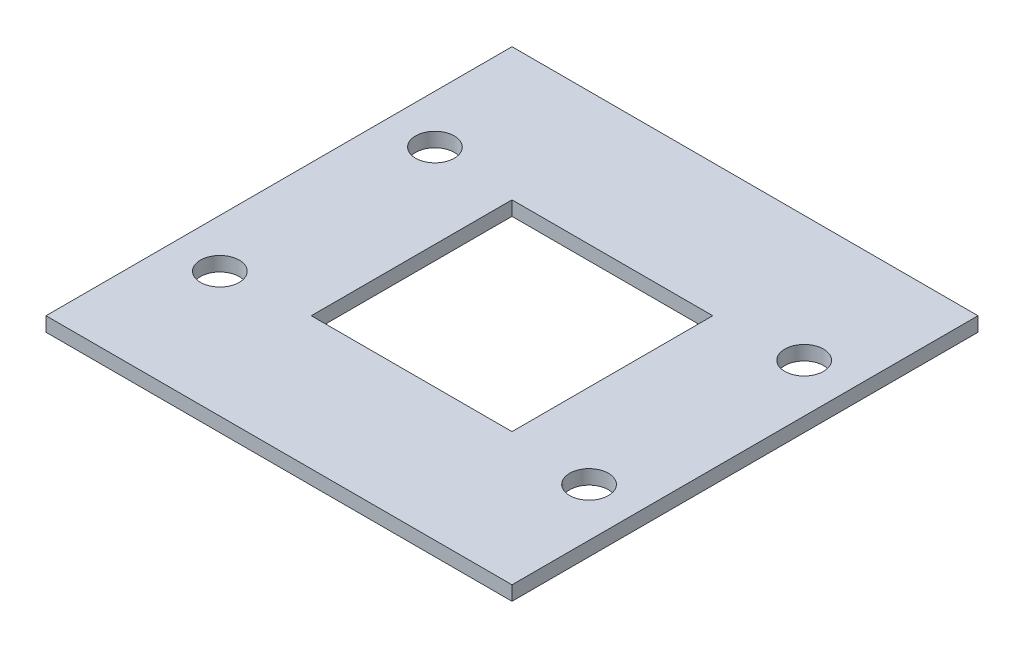
from build123d import *

# Parameters (mm, degrees)
CROQUIS1_W              = 55
CROQUIS1_H              = 55
CROQUIS1_R              = 1.5
SALIENTE_EXTRUIR1_DEPTH = 2
CROQUIS3_W              = 65
CROQUIS3_H              = 65
CROQUIS3_W_2            = 55
CROQUIS3_H_2            = 55
SALIENTE_EXTRUIR2_DEPTH = 2
CROQUIS4_R              = 2.7
CORTAR_EXTRUIR1_DEPTH   = 2


with BuildPart() as part:
    # Croquis1 → Saliente-Extruir1 (new body)
    with BuildSketch(Plane(origin=(0, 0, 0), x_dir=(1, 0, 0), z_dir=(0, 1, 0))):
        with Locations((27.5, 27.5)):
            Rectangle(CROQUIS1_W, CROQUIS1_H)
        with Locations(Location((1.75, 42.5, 0), (0, 0, 270))):
            Circle(CROQUIS1_R, mode=Mode.SUBTRACT)
        with Locations(Location((1.75, 12.5, 0), (0, 0, 270))):
            Circle(CROQUIS1_R, mode=Mode.SUBTRACT)
        with Locations(Location((53.25, 42.5, 0), (0, 0, 90))):
            Circle(CROQUIS1_R, mode=Mode.SUBTRACT)
        with Locations(Location((53.25, 12.5, 0), (0, 0, 90))):
            Circle(CROQUIS1_R, mode=Mode.SUBTRACT)
        Polygon((13.5, 13.5), (27.5, 13.5), (41.5, 13.5), (41.5, 28.15), (41.5, 41.5), (27.5, 41.5), (13.5, 41.5), (13.5, 27.5), align=None, mode=Mode.SUBTRACT)
    extrude(amount=SALIENTE_EXTRUIR1_DEPTH)

    # Croquis3 → Saliente-Extruir2 (add)
    with BuildSketch(Plane(origin=(0, 2, 0), x_dir=(1, 0, 0), z_dir=(0, 1, 0))):
        with Locations((27.5, 27.5)):
            Rectangle(CROQUIS3_W, CROQUIS3_H)
        with Locations((27.5, 27.5)):
            Rectangle(CROQUIS3_W_2, CROQUIS3_H_2, mode=Mode.SUBTRACT)
    extrude(amount=-SALIENTE_EXTRUIR2_DEPTH)

    # Croquis4 → Cortar-Extruir1 (cut)
    with BuildSketch(Plane(origin=(0, 2, 0), x_dir=(1, 0, 0), z_dir=(0, 1, 0))):
        with Locations(Location((53.25, 42.5, 0), (0, 0, 270))):
            Circle(CROQUIS4_R)
        with Locations(Location((53.25, 12.5, 0), (0, 0, 270))):
            Circle(CROQUIS4_R)
        with Locations(Location((1.75, 12.5, 0), (0, 0, 270))):
            Circle(CROQUIS4_R)
        with Locations(Location((1.75, 42.5, 0), (0, 0, 270))):
            Circle(CROQUIS4_R)
    extrude(amount=-CORTAR_EXTRUIR1_DEPTH, mode=Mode.SUBTRACT)


solid = part.part
